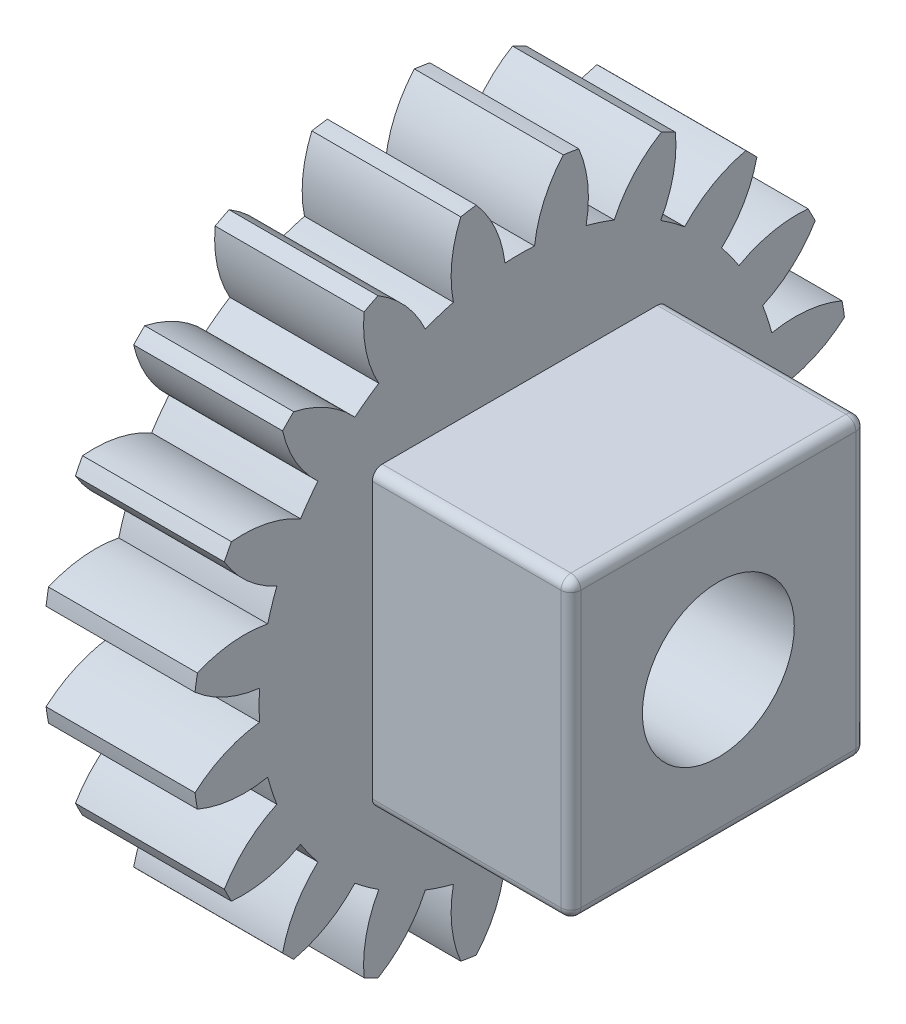
from build123d import *

# Parameters (mm, degrees)
BASPROSKE_W         = 15
BASPROSKE_H         = 33
TOOTHCUT_DEPTH      = 50.020403915
TEETHCUTS_COUNT     = 20
TEETHCUTS_ANGLE     = 342
BORSKE_R            = 2
BORE_DEPTH          = 50.0000508
SKETCH1_W           = 29.7
SKETCH1_H           = 29.7
BOSS_EXTRUDE1_DEPTH = 20
SKETCH2_R           = 7.65
CUT_EXTRUDE1_DEPTH  = 35
FILLET2_R           = 1


with BuildPart() as part:
    # BasProSke → Base-Revolve (revolve)
    with BuildSketch(Plane(origin=(0, 0, 0), x_dir=(1, 0, 0), z_dir=(0, 1, 0)), mode=Mode.PRIVATE) as base_revolve_sk:
        with Locations((7.5, 16.5)):
            Rectangle(BASPROSKE_W, BASPROSKE_H)
    revolve(base_revolve_sk.sketch.rotate(Axis((-10, 0, 0), (1, 0, 0)), 180), axis=Axis((-10, 0, 0), (1, 0, 0)))

    # TooCutSke → ToothCut (cut, through all)
    with BuildSketch(Plane(origin=(0, 0, 0), x_dir=(0, 0, -1), z_dir=(1, 0, 0))):
        with BuildLine():
            ThreePointArc((1.489278925, 26.206717637), (0, 26.249), (-1.489278925, 26.206717637))
            ThreePointArc((-1.489278925, 26.206717637), (-2.448651415, 29.690511169), (-4.401620335, 32.730762038))
            ThreePointArc((-4.401620335, 32.730762038), (0, 33.0254), (4.401620335, 32.730762038))
            ThreePointArc((4.401620335, 32.730762038), (2.448651415, 29.690511169), (1.489278925, 26.206717637))
        make_face()
    toothcut = extrude(amount=TOOTHCUT_DEPTH, mode=Mode.SUBTRACT)

    # TeethCuts: ToothCut ×20 about axis
    teethcuts_axis = Axis((-10, 0, 0), (1, 0, 0))
    for i in range(1, TEETHCUTS_COUNT):
        add(toothcut.rotate(teethcuts_axis, i * TEETHCUTS_ANGLE / (TEETHCUTS_COUNT - 1)), mode=Mode.SUBTRACT)

    # BorSke → Bore (cut, symmetric)
    with BuildSketch(Plane(origin=(0, 0, 0), x_dir=(0, 0, -1), z_dir=(1, 0, 0))):
        with Locations(Location((0, 0, 0), (0, 0, 180))):
            Circle(BORSKE_R)
    extrude(amount=BORE_DEPTH, both=True, mode=Mode.SUBTRACT)

    # Sketch1 → Boss-Extrude1 (add)
    with BuildSketch(Plane(origin=(15, 0, 0), x_dir=(0, 0, -1), z_dir=(1, 0, 0))):
        Rectangle(SKETCH1_W, SKETCH1_H)
    extrude(amount=BOSS_EXTRUDE1_DEPTH)

    # Sketch2 → Cut-Extrude1 (cut)
    with BuildSketch(Plane.ZY):
        Circle(SKETCH2_R)
    extrude(amount=-CUT_EXTRUDE1_DEPTH, mode=Mode.SUBTRACT)

    # Fillet2
    fillet2_edges = [part.edges().sort_by_distance(p)[0] for p in [
        (25, 14.85, 14.85),
        (25, -14.85, 14.85),
        (25, -14.85, -14.85),
        (25, 14.85, -14.85),
        (35, 0, 14.85),
        (35, -14.85, 0),
        (35, 0, -14.85),
        (35, 14.85, 0),
    ]]
    fillet(fillet2_edges, radius=FILLET2_R)


solid = part.part
